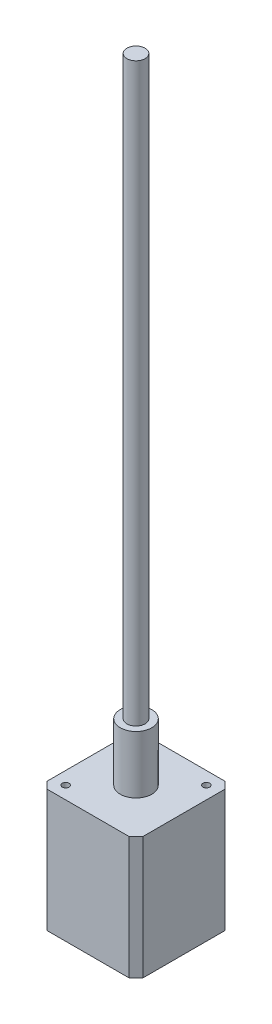
from build123d import *

# Parameters (mm, degrees)
SKETCH1_W           = 42.25
SKETCH1_H           = 42.25
BOSS_EXTRUDE1_DEPTH = 54
SKETCH2_R           = 1.5
CUT_EXTRUDE1_DEPTH  = 3
CHAMFER1_SIZE       = 3


with BuildPart() as part:
    # Sketch1 → Boss-Extrude1 (new body)
    with BuildSketch(Plane(origin=(0, 0, 0), x_dir=(1, 0, 0), z_dir=(0, 1, 0))):
        with Locations((21.125, 21.125)):
            Rectangle(SKETCH1_W, SKETCH1_H)
    extrude(amount=BOSS_EXTRUDE1_DEPTH)

    # Sketch2 → Cut-Extrude1 (cut)
    with BuildSketch(Plane(origin=(0, 54, 0), x_dir=(1, 0, 0), z_dir=(0, 1, 0))):
        with Locations(Location((36.625, 36.625, 0), (0, 0, 270))):
            Circle(SKETCH2_R)
        with Locations(Location((5.625, 5.625, 0), (0, 0, 270))):
            Circle(SKETCH2_R)
    extrude(amount=-CUT_EXTRUDE1_DEPTH, mode=Mode.SUBTRACT)

    # Chamfer1
    chamfer1_edges = [part.edges().sort_by_distance(p)[0] for p in [
        (0, 27, -42.25),
        (42.25, 27, -42.25),
        (42.25, 27, 0),
        (0, 27, 0),
    ]]
    chamfer(chamfer1_edges, length=CHAMFER1_SIZE)

    # Sketch3 → Revolve1 (revolve)
    with BuildSketch(Plane.ZY.offset(-21.125)):
        Polygon((-21.125, 54), (-21.125, 333.4), (-25.125, 333.4), (-25.125, 79.4), (-28.075, 79.4), (-28.075, 54), align=None)
    revolve(axis=Axis((21.125, 54, -21.125), (0, 1, 0)))


solid = part.part
